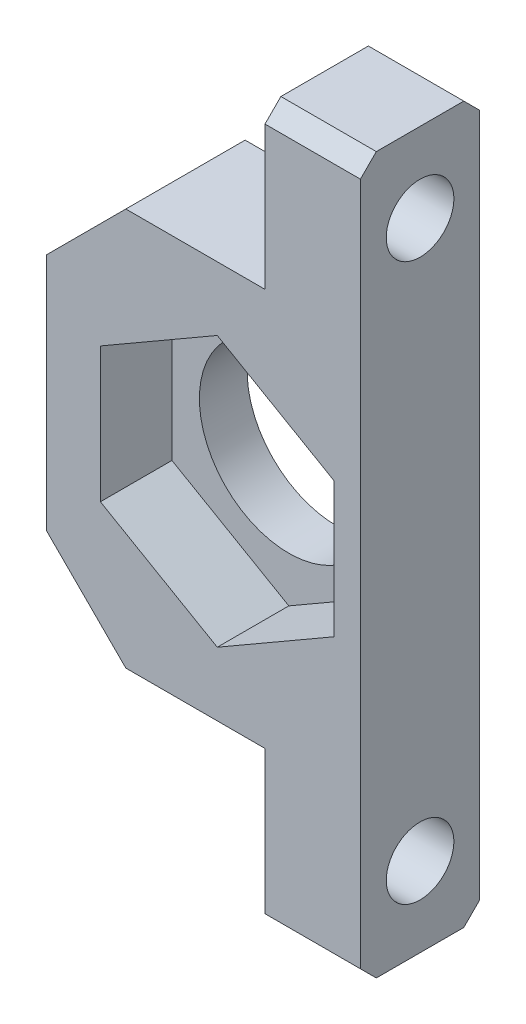
from build123d import *

# Parameters (mm, degrees)
SKETCH_1_R          = 11.25
EXTRUDE_1_DEPTH     = 15
CHAMFER_1_SIZE      = 10
SKETCH_2_R          = 4.25
CUT_EXTRUDE_1_DEPTH = 397.745051815
CUT_EXTRUDE_2_DEPTH = 9
CHAMFER_2_SIZE      = 2


with BuildPart() as part:
    # 草图1 → 凸台-拉伸1 (new body)
    with BuildSketch(Plane.XY):
        Polygon((-52, 375.506526422), (-79.499521759, 375.506526422), (-79.499521759, 325.506526422), (-52, 325.506526422), (-52, 305.506526422), (-40, 305.506526422), (-40, 395.506526422), (-52, 395.506526422), align=None)
        with Locations((-58, 350.506526422)):
            Circle(SKETCH_1_R, mode=Mode.SUBTRACT)
    extrude(amount=EXTRUDE_1_DEPTH)

    # 倒角1
    chamfer_1_edges = [part.edges().sort_by_distance(p)[0] for p in [
        (-79.499521759, 375.506526422, 7.5),
        (-79.499521759, 325.506526422, 7.5),
    ]]
    chamfer(chamfer_1_edges, length=CHAMFER_1_SIZE)

    # 草图2 → 切除-拉伸1 (cut, through all)
    with BuildSketch(Plane.ZY.offset(52)):
        with Locations((7.5, 385.506526422)):
            Circle(SKETCH_2_R)
        with Locations((7.5, 315.506526422)):
            Circle(SKETCH_2_R)
    extrude(amount=-CUT_EXTRUDE_1_DEPTH, mode=Mode.SUBTRACT)

    # 草图3 → 切除-拉伸2 (cut)
    with BuildSketch(Plane.XY.offset(15)):
        Polygon((-58, 367.480624336), (-72.7, 358.993575379), (-72.7, 342.019477465), (-58, 333.532428508), (-43.3, 342.019477465), (-43.3, 358.993575379), align=None)
    extrude(amount=-CUT_EXTRUDE_2_DEPTH, mode=Mode.SUBTRACT)

    # 倒角2
    chamfer_2_edges = [part.edges().sort_by_distance(p)[0] for p in [
        (-46, 305.506526422, 15),
        (-46, 395.506526422, 15),
        (-46, 395.506526422, 0),
        (-46, 305.506526422, 0),
    ]]
    chamfer(chamfer_2_edges, length=CHAMFER_2_SIZE)


solid = part.part
